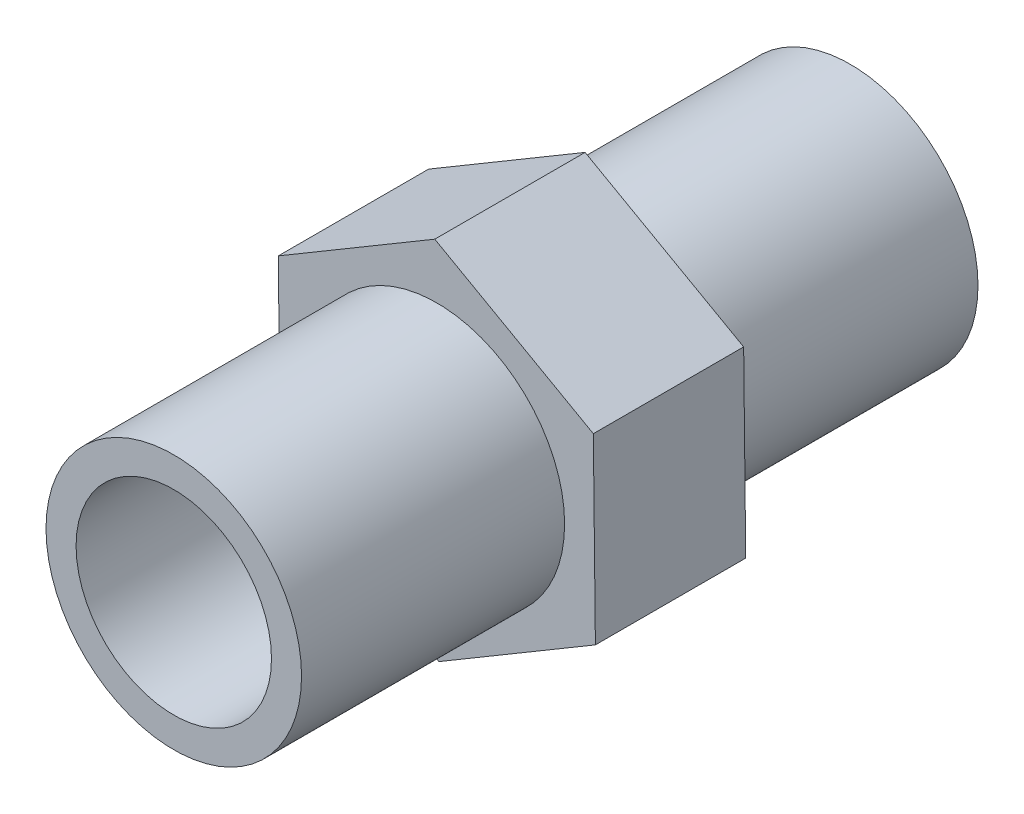
from build123d import *

# Parameters (mm, degrees)
SKETCH1_R           = 8.5
SKETCH1_R_2         = 6.5
EXTRUDE_THIN1_DEPTH = 22.5
BOSS_EXTRUDE1_DEPTH = 5


with BuildPart() as part:
    # Sketch1 → Extrude-Thin1 (new, symmetric)
    with BuildSketch(Plane.XY):
        Circle(SKETCH1_R)
        Circle(SKETCH1_R_2, mode=Mode.SUBTRACT)
    extrude(amount=EXTRUDE_THIN1_DEPTH, both=True)

    # Sketch2 → Boss-Extrude1 (add, symmetric)
    with BuildSketch(Plane.XY):
        Polygon((10.411055183, 6.168480417), (-0.136533152, 12.100478477), (-10.547588335, 5.93199806), (-10.411055183, -6.168480417), (0.136533152, -12.100478477), (10.547588335, -5.93199806), align=None)
    extrude(amount=BOSS_EXTRUDE1_DEPTH, both=True)


solid = part.part
